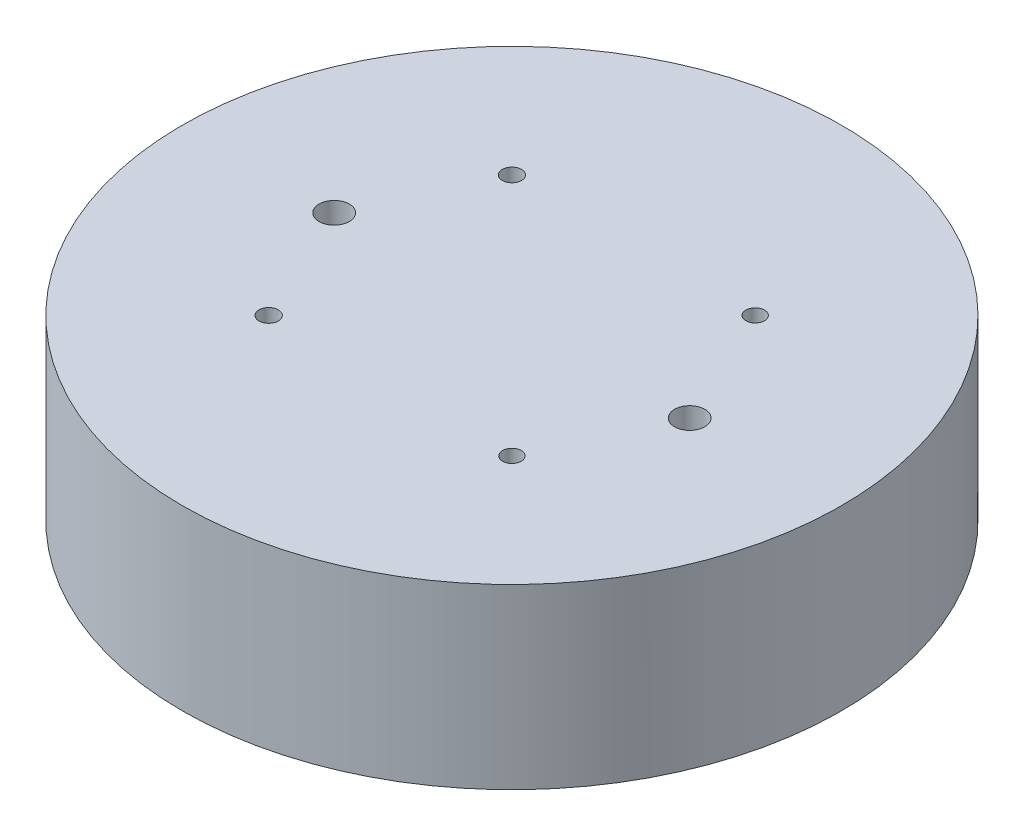
from build123d import *

# Parameters (mm, degrees)
SKETCH2_R               = 56.515
SKETCH2_R_2             = 51.435
BOSS_EXTRUDE1_DEPTH     = 15.24
SKETCH2_R_3             = 47.201666667
SKETCH2_R_4             = 42.121666667
BOSS_EXTRUDE1_2_DEPTH   = 15.24
SKETCH3_R               = 56.515
BOSS_EXTRUDE2_DEPTH     = 15.24
CUT_EXTRUDE1_DEPTH      = 86.539001923
CUT_EXTRUDE1_DEPTH_BACK = 86.539001923
SKETCH4_R               = 1.6
SKETCH4_R_2             = 1.65876763
SKETCH4_R_3             = 1.651
SKETCH14_R              = 10
CUT_EXTRUDE7_DEPTH      = 19.558
SKETCH16_W              = 1.27
SKETCH16_H              = 1.27
EXTRUDE_THIN1_DEPTH     = 15.24
SKETCH20_R              = 66.675
SKETCH20_R_2            = 56.515
CUT_EXTRUDE_THIN3_DEPTH = 15.748
CUT_EXTRUDE12_DEPTH     = 15.748
SKETCH24_R              = 2.6
CUT_EXTRUDE15_DEPTH     = 7.62
SKETCH25_R              = 7.5
CUT_EXTRUDE16_DEPTH     = 7.62


with BuildPart() as part:
    # Sketch2 → Boss-Extrude1 (new body)
    with BuildSketch(Plane(origin=(0, 0, 0), x_dir=(1, 0, 0), z_dir=(0, 1, 0))):
        with Locations(Location((0, 0, 0), (0, 0, 90))):
            Circle(SKETCH2_R)
        with Locations(Location((0, 0, 0), (0, 0, 90))):
            Circle(SKETCH2_R_2, mode=Mode.SUBTRACT)
    extrude(amount=BOSS_EXTRUDE1_DEPTH)



with BuildPart() as body_2:
    # Sketch2 → Boss-Extrude1 2 (new body)
    with BuildSketch(Plane(origin=(0, 0, 0), x_dir=(1, 0, 0), z_dir=(0, 1, 0))):
        with Locations(Location((0, 0, 0), (0, 0, 90))):
            Circle(SKETCH2_R_3)
        with Locations(Location((0, 0, 0), (0, 0, 90))):
            Circle(SKETCH2_R_4, mode=Mode.SUBTRACT)
    extrude(amount=BOSS_EXTRUDE1_2_DEPTH)


with BuildPart() as part_1:
    add(part.part)

    add(body_2.part)  # Boss-Extrude2 merges body 2
    # Sketch3 → Boss-Extrude2 (add)
    with BuildSketch(Plane(origin=(0, 15.24, 0), x_dir=(1, 0, 0), z_dir=(0, 1, 0))):
        with Locations(Location((0, 0, 0), (0, 0, 90))):
            Circle(SKETCH3_R)
    extrude(amount=BOSS_EXTRUDE2_DEPTH)

    # Sketch4 → Cut-Extrude1 (cut, two sides: drawn at the far end of the back side and taken through both)
    with BuildSketch(Plane(origin=(0, 30.48, 0), x_dir=(1, 0, 0), z_dir=(0, 1, 0)).offset(-CUT_EXTRUDE1_DEPTH_BACK)):
        with Locations(Location((20.859650045, 20.859650045, 0), (0, 0, 270))):
            Circle(SKETCH4_R)
        with Locations(Location((20.859650045, -20.859650045, 0), (0, 0, 270))):
            Circle(SKETCH4_R)
        with Locations(Location((-20.859650045, -20.859650045, 0), (0, 0, 270))):
            Circle(SKETCH4_R_2)
        with Locations(Location((-20.859650045, 20.859650045, 0), (0, 0, 270))):
            Circle(SKETCH4_R_3)
    extrude(amount=CUT_EXTRUDE1_DEPTH + CUT_EXTRUDE1_DEPTH_BACK, mode=Mode.SUBTRACT)

    # Sketch14 → Cut-Extrude7 (cut)
    with BuildSketch(Plane.XY.offset(-56.515)):
        with Locations((0, 5.08)):
            Circle(SKETCH14_R)
    extrude(amount=CUT_EXTRUDE7_DEPTH, mode=Mode.SUBTRACT)

    # Sketch16 → Extrude-Thin1 (add)
    # profile 1 of 2: a face of its own
    with BuildSketch(Plane.XY.offset(-56.515)):
        with Locations((-0.635, 0.635)):
            Rectangle(SKETCH16_W, SKETCH16_H)
    # profile 2 of 2: a face of its own
    with BuildSketch(Plane.XY.offset(-56.515)):
        with BuildLine():
            Line((10.060144134, 0), (-10.060144134, 0))
            ThreePointArc((-10.060144134, 0), (0, 16.35), (10.060144134, 0))
        make_face()
        with BuildLine():
            Line((9.245750375, 1.27), (-9.245750375, 1.27))
            ThreePointArc((-9.245750375, 1.27), (0, 15.08), (9.245750375, 1.27))
        make_face(mode=Mode.SUBTRACT)
    extrude(amount=EXTRUDE_THIN1_DEPTH)

    # Sketch20 → Cut-Extrude-Thin3 (cut)
    with BuildSketch(Plane(origin=(0, 0, 0), x_dir=(-1, 0, 0), z_dir=(0, -1, 0))):
        Circle(SKETCH20_R)
        Circle(SKETCH20_R_2, mode=Mode.SUBTRACT)
    extrude(amount=-CUT_EXTRUDE_THIN3_DEPTH, mode=Mode.SUBTRACT)

    # Sketch21 → Cut-Extrude12 (cut)
    with BuildSketch(Plane.XY.offset(-56.515)):
        Polygon((-9.303733138, 0), (-9.245750375, 1.27), (9.245750375, 1.27), (9.245750375, 0), align=None)
    extrude(amount=CUT_EXTRUDE12_DEPTH, mode=Mode.SUBTRACT)

    # Sketch24 → Cut-Extrude15 (cut)
    with BuildSketch(Plane(origin=(0, 30.48, 0), x_dir=(1, 0, 0), z_dir=(0, 1, 0))):
        with Locations(Location((30.48, 0, 0), (0, 0, 270))):
            Circle(SKETCH24_R)
        with Locations(Location((-30.48, 0, 0), (0, 0, 270))):
            Circle(SKETCH24_R)
    extrude(amount=-CUT_EXTRUDE15_DEPTH, mode=Mode.SUBTRACT)

    # Sketch25 → Cut-Extrude16 (cut)
    with BuildSketch(Plane(origin=(0, 15.24, 0), x_dir=(-1, 0, 0), z_dir=(0, -1, 0))):
        with Locations(Location((30.48, 0, 0), (0, 0, 90))):
            Circle(SKETCH25_R)
        with Locations(Location((-30.48, 0, 0), (0, 0, 90))):
            Circle(SKETCH25_R)
    extrude(amount=-CUT_EXTRUDE16_DEPTH, mode=Mode.SUBTRACT)


solid = part_1.part
